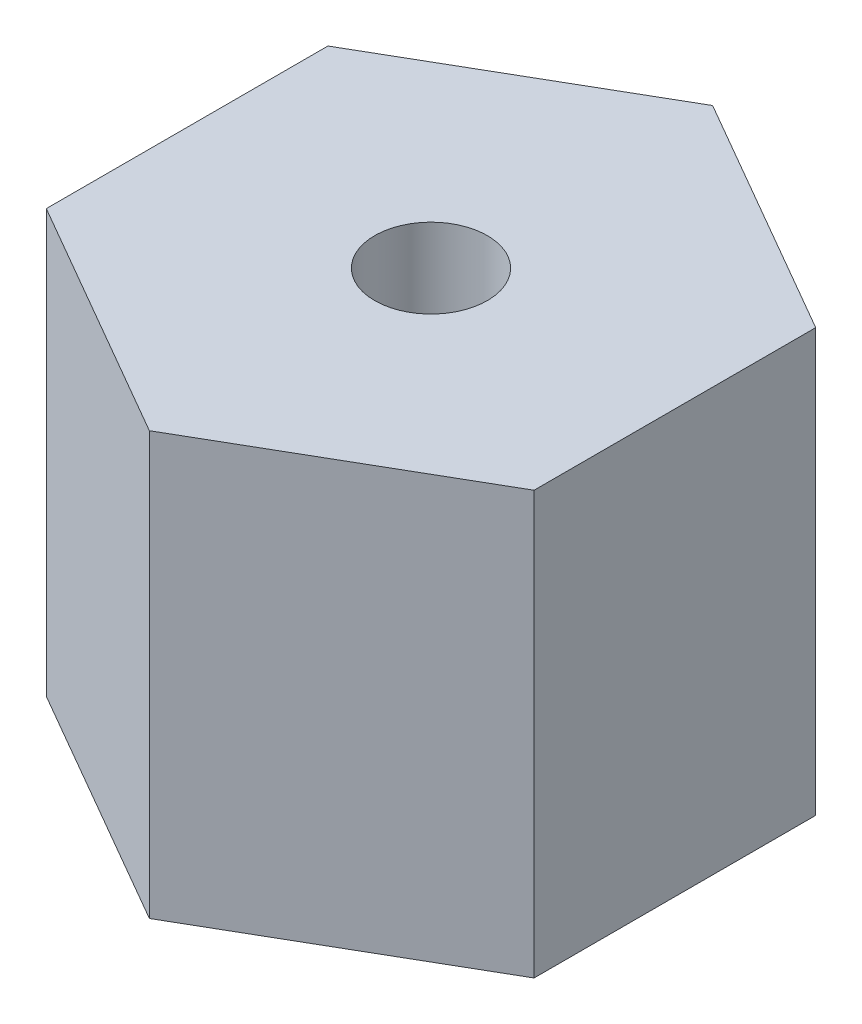
from build123d import *

# Parameters (mm, degrees)
SKETCH2_R           = 2
BOSS_EXTRUDE1_DEPTH = 15
SKETCH2_4_R         = 3
SKETCH2_4_R_2       = 2
CUT_EXTRUDE1_DEPTH  = 9


with BuildPart() as part:
    # Sketch2 → Boss-Extrude1 (new body)
    with BuildSketch(Plane(origin=(0, 0, 0), x_dir=(1, 0, 0), z_dir=(0, 1, 0))):
        Polygon((8.660254038, 5), (0, 10), (-8.660254038, 5), (-8.660254038, -5), (0, -10), (8.660254038, -5), align=None)
        Circle(SKETCH2_R, mode=Mode.SUBTRACT)
    extrude(amount=BOSS_EXTRUDE1_DEPTH)

    # Sketch2<4> → Cut-Extrude1 (cut)
    with BuildSketch(Plane(origin=(0, 0, 0), x_dir=(1, 0, 0), z_dir=(0, 1, 0))):
        Circle(SKETCH2_4_R)
        Circle(SKETCH2_4_R_2, mode=Mode.SUBTRACT)
    extrude(amount=CUT_EXTRUDE1_DEPTH, mode=Mode.SUBTRACT)


solid = part.part
